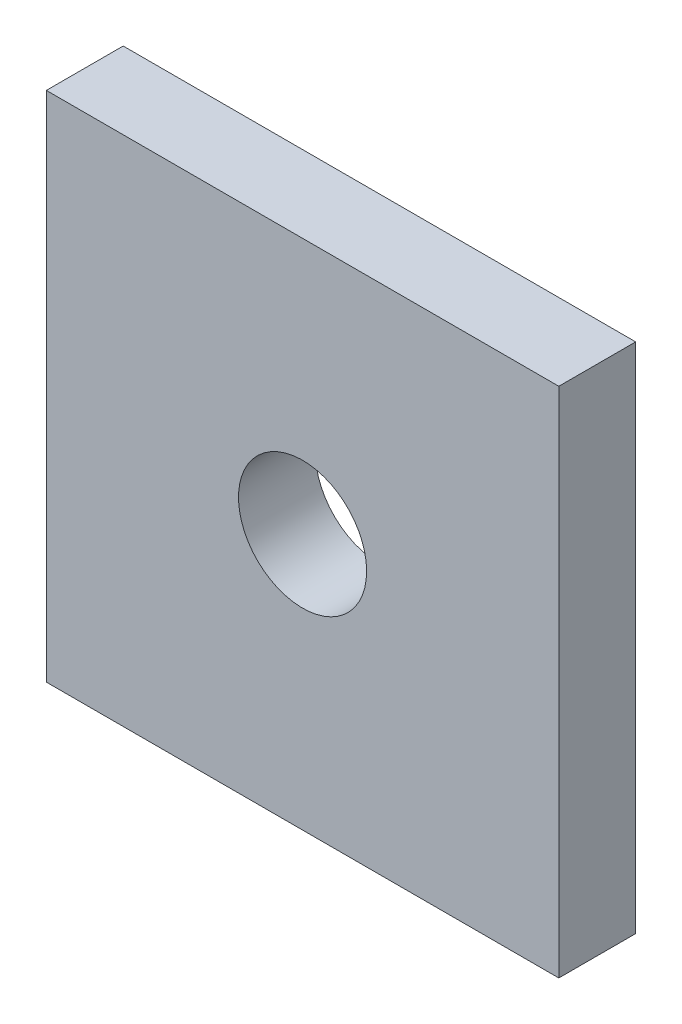
from build123d import *

# Parameters (mm, degrees)
ESBO_O1_W                = 20
ESBO_O1_H                = 20
ESBO_O1_R                = 2.5
RESSALTO_EXTRUS_O1_DEPTH = 3


with BuildPart() as part:
    # Esboço1 → Ressalto-extrusão1 (new body)
    with BuildSketch(Plane.XY):
        Rectangle(ESBO_O1_W, ESBO_O1_H)
        Circle(ESBO_O1_R, mode=Mode.SUBTRACT)
    extrude(amount=RESSALTO_EXTRUS_O1_DEPTH)


solid = part.part
